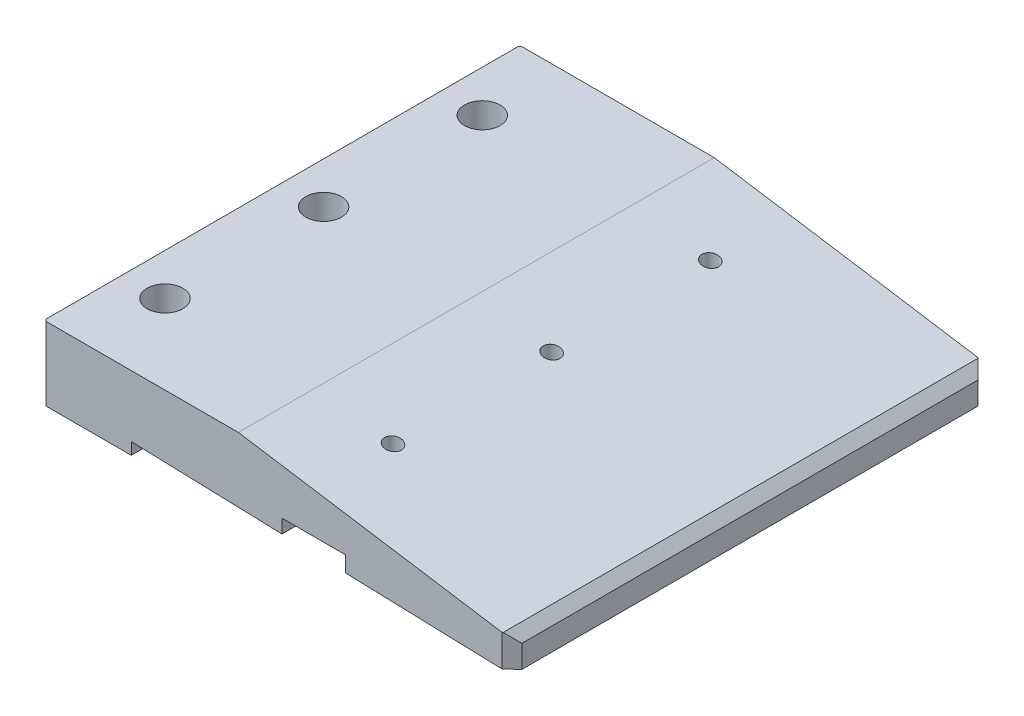
from build123d import *

# Parameters (mm, degrees)
EXTRUDE_1_DEPTH           = 120
HOLE_WIZARD_1_D           = 9
HOLE_WIZARD_1_CBORE_D     = 15
HOLE_WIZARD_1_CBORE_DEPTH = 9
CUT_EXTRUDE_1_REACH       = 172.22
SKETCH_6_R                = 2.1
CHAMFER_2_SIZE            = 2.5
CHAMFER_3_SIZE            = 2
CHAMFER_3_SIZE2           = 2.400003543
CHAMFER_4_SIZE            = 2


with BuildPart() as part:
    # 草图1 → 凸台-拉伸1 (new body)
    with BuildSketch(Plane.XY):
        Polygon((0, 0), (51, 0), (120, -10.8), (120, -18.5), (78, -17.1875), (78, -13.2175), (62, -13.2175), (62, -16.6875), (24, -15.5), (24, -18.5), (0, -18.5), align=None)
    extrude(amount=EXTRUDE_1_DEPTH)

    # 孔1 (through all)
    with Locations(Plane(origin=(0, -18.5, 0), x_dir=(-1, 0, 0), z_dir=(0, -1, 0))):
        with Locations((-12.5, -20), (-12.5, -60), (-12.5, -100)):
            CounterBoreHole(HOLE_WIZARD_1_D / 2, HOLE_WIZARD_1_CBORE_D / 2, HOLE_WIZARD_1_CBORE_DEPTH)

    # 切除-拉伸1: up to this plane
    cut_extrude_1_end = Plane(origin=(51, 0, 120), z_dir=(-0.15463894699101186, -0.9879710502203549, 0))
    # 草图6 → 切除-拉伸1 (cut, up to the surface)
    with BuildSketch(Plane.XZ.offset(13.2175), mode=Mode.PRIVATE) as cut_extrude_1_sk1:
        with Locations((70, 100)):
            Circle(SKETCH_6_R)
    cut_extrude_1_tool1 = split(extrude(cut_extrude_1_sk1.sketch, amount=-CUT_EXTRUDE_1_REACH, mode=Mode.PRIVATE), bisect_by=cut_extrude_1_end, keep=Keep.BOTH, mode=Mode.PRIVATE)
    add(cut_extrude_1_tool1.solids().sort_by_distance((70, -13.2175, 100))[0], mode=Mode.SUBTRACT)
    # 草图6 → 切除-拉伸1 (cut, up to the surface)
    with BuildSketch(Plane.XZ.offset(13.2175), mode=Mode.PRIVATE) as cut_extrude_1_sk2:
        with Locations((70, 60)):
            Circle(SKETCH_6_R)
    cut_extrude_1_tool2 = split(extrude(cut_extrude_1_sk2.sketch, amount=-CUT_EXTRUDE_1_REACH, mode=Mode.PRIVATE), bisect_by=cut_extrude_1_end, keep=Keep.BOTH, mode=Mode.PRIVATE)
    add(cut_extrude_1_tool2.solids().sort_by_distance((70, -13.2175, 60))[0], mode=Mode.SUBTRACT)
    # 草图6 → 切除-拉伸1 (cut, up to the surface)
    with BuildSketch(Plane.XZ.offset(13.2175), mode=Mode.PRIVATE) as cut_extrude_1_sk3:
        with Locations((70, 20)):
            Circle(SKETCH_6_R)
    cut_extrude_1_tool3 = split(extrude(cut_extrude_1_sk3.sketch, amount=-CUT_EXTRUDE_1_REACH, mode=Mode.PRIVATE), bisect_by=cut_extrude_1_end, keep=Keep.BOTH, mode=Mode.PRIVATE)
    add(cut_extrude_1_tool3.solids().sort_by_distance((70, -13.2175, 20))[0], mode=Mode.SUBTRACT)

    # 倒角2
    chamfer_2_edges = [part.edges().sort_by_distance(p)[0] for p in [
        (120, -14.65, 0),
        (0, -9.25, 0),
        (120, -14.65, 120),
        (0, -9.25, 120),
    ]]
    chamfer(chamfer_2_edges, length=CHAMFER_2_SIZE)

    # 倒角3
    chamfer_3_edges = [part.edges().sort_by_distance(p)[0] for p in [
        (120, -10.8, 60),
    ]]
    chamfer_3_side = [part.faces().sort_by_distance(p)[0] for p in [
        (120, -14.65, 60),
    ]]
    chamfer(chamfer_3_edges, length=CHAMFER_3_SIZE, length2=CHAMFER_3_SIZE2, reference=chamfer_3_side[0])

    # 倒角4
    chamfer_4_edges = [part.edges().sort_by_distance(p)[0] for p in [
        (0, 0, 60),
    ]]
    chamfer(chamfer_4_edges, length=CHAMFER_4_SIZE)


solid = part.part
